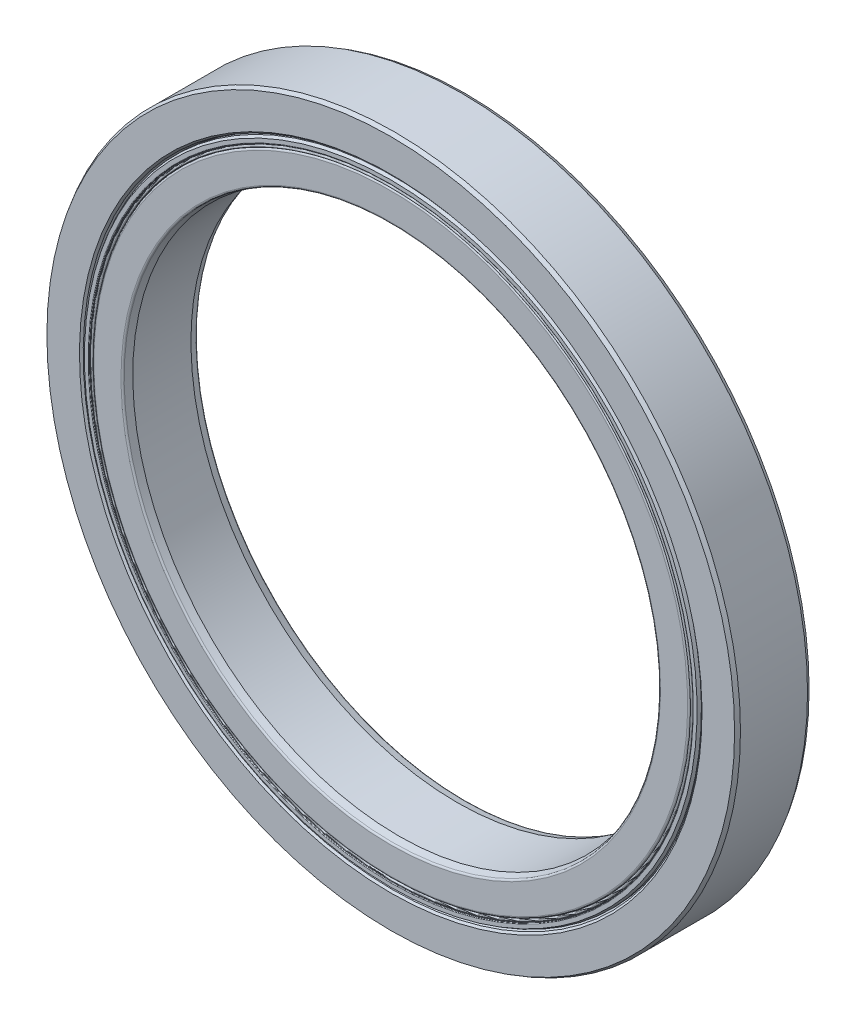
from build123d import *

# Parameters (mm, degrees)
CIRPATTERN1_COUNT = 20


with BuildPart() as part:
    # Sketch3 → Revolve1 (revolve)
    with BuildSketch(Plane(origin=(0, 0, 0), x_dir=(0, 0, -1), z_dir=(1, 0, 0)), mode=Mode.PRIVATE) as revolve1_sk:
        with BuildLine():
            Line((-2.945227749, 28.925), (-3.325, 29.063225795))
            Line((-3.325, 29.063225795), (-3.5, 29.238225795))
            Line((-3.5, 29.238225795), (-3.5, 32.297927406))
            Line((-3.5, 32.297927406), (-3.15, 32.5))
            Line((-3.15, 32.5), (3.15, 32.5))
            Line((3.15, 32.5), (3.5, 32.297927406))
            Line((3.5, 32.297927406), (3.5, 29.238225795))
            Line((3.5, 29.238225795), (3.325, 29.063225795))
            Line((3.325, 29.063225795), (2.945227749, 28.925))
            Line((2.945227749, 28.925), (2.779563315, 28.925))
            ThreePointArc((2.779563315, 28.925), (0, 31.308333333), (-2.779563315, 28.925))
            Line((-2.779563315, 28.925), (-2.945227749, 28.925))
        make_face()
    revolve(revolve1_sk.sketch.rotate(Axis((0, 0, 3.5), (0, 0, -1)), 180), axis=Axis((0, 0, 3.5), (0, 0, -1)))


with BuildPart() as body_2:
    # Sketch4 → Revolve2 (revolve)
    with BuildSketch(Plane(origin=(0, 0, 0), x_dir=(0, 0, -1), z_dir=(1, 0, 0)), mode=Mode.PRIVATE) as revolve2_sk:
        with BuildLine():
            Line((-2.731356293, 25), (-3.368914973, 25.170833333))
            ThreePointArc((-3.368914973, 25.170833333), (-3.463452538, 25.234001315), (-3.5, 25.341666667))
            Line((-3.5, 25.341666667), (-3.5, 27.889806986))
            ThreePointArc((-3.5, 27.889806986), (-3.448198999, 28.014865665), (-3.323140319, 28.066666667))
            Line((-3.323140319, 28.066666667), (-2.779563315, 28.066666667))
            ThreePointArc((-2.779563315, 28.066666667), (0, 25.683333333), (2.779563315, 28.066666667))
            Line((2.779563315, 28.066666667), (3.323140319, 28.066666667))
            ThreePointArc((3.323140319, 28.066666667), (3.448198999, 28.014865665), (3.5, 27.889806986))
            Line((3.5, 27.889806986), (3.5, 25.341666667))
            ThreePointArc((3.5, 25.341666667), (3.463452538, 25.234001315), (3.368914973, 25.170833333))
            Line((3.368914973, 25.170833333), (2.731356293, 25))
            Line((2.731356293, 25), (-2.731356293, 25))
        make_face()
    revolve(revolve2_sk.sketch.rotate(Axis((0, 0, 3.5), (0, 0, -1)), 180), axis=Axis((0, 0, 3.5), (0, 0, -1)))


with BuildPart() as body_3:
    # Sketch5 → Revolve3 (revolve)
    with BuildSketch(Plane(origin=(0, 0, 0), x_dir=(0, 0, -1), z_dir=(1, 0, 0))):
        with BuildLine():
            Line((-2.8125, 28.495833333), (2.8125, 28.495833333))
            ThreePointArc((2.8125, 28.495833333), (0, 31.308333333), (-2.8125, 28.495833333))
        make_face()
    revolve(axis=Axis((0, 28.495833333, 2.8125), (0, 0, -1)))


with BuildPart() as cirpattern1_1:
    # CirPattern1: pattern copy
    add(body_3.part.rotate(Axis((0, 0, 0), (0, 0, 1)), 1 * 360 / CIRPATTERN1_COUNT))


with BuildPart() as cirpattern1_2:
    # CirPattern1: pattern copy
    add(body_3.part.rotate(Axis((0, 0, 0), (0, 0, 1)), 2 * 360 / CIRPATTERN1_COUNT))


with BuildPart() as cirpattern1_3:
    # CirPattern1: pattern copy
    add(body_3.part.rotate(Axis((0, 0, 0), (0, 0, 1)), 3 * 360 / CIRPATTERN1_COUNT))


with BuildPart() as cirpattern1_4:
    # CirPattern1: pattern copy
    add(body_3.part.rotate(Axis((0, 0, 0), (0, 0, 1)), 4 * 360 / CIRPATTERN1_COUNT))


with BuildPart() as cirpattern1_5:
    # CirPattern1: pattern copy
    add(body_3.part.rotate(Axis((0, 0, 0), (0, 0, 1)), 5 * 360 / CIRPATTERN1_COUNT))


with BuildPart() as cirpattern1_6:
    # CirPattern1: pattern copy
    add(body_3.part.rotate(Axis((0, 0, 0), (0, 0, 1)), 6 * 360 / CIRPATTERN1_COUNT))


with BuildPart() as cirpattern1_7:
    # CirPattern1: pattern copy
    add(body_3.part.rotate(Axis((0, 0, 0), (0, 0, 1)), 7 * 360 / CIRPATTERN1_COUNT))


with BuildPart() as cirpattern1_8:
    # CirPattern1: pattern copy
    add(body_3.part.rotate(Axis((0, 0, 0), (0, 0, 1)), 8 * 360 / CIRPATTERN1_COUNT))


with BuildPart() as cirpattern1_9:
    # CirPattern1: pattern copy
    add(body_3.part.rotate(Axis((0, 0, 0), (0, 0, 1)), 9 * 360 / CIRPATTERN1_COUNT))


with BuildPart() as cirpattern1_10:
    # CirPattern1: pattern copy
    add(body_3.part.rotate(Axis((0, 0, 0), (0, 0, 1)), 10 * 360 / CIRPATTERN1_COUNT))


with BuildPart() as cirpattern1_11:
    # CirPattern1: pattern copy
    add(body_3.part.rotate(Axis((0, 0, 0), (0, 0, 1)), 11 * 360 / CIRPATTERN1_COUNT))


with BuildPart() as cirpattern1_12:
    # CirPattern1: pattern copy
    add(body_3.part.rotate(Axis((0, 0, 0), (0, 0, 1)), 12 * 360 / CIRPATTERN1_COUNT))


with BuildPart() as cirpattern1_13:
    # CirPattern1: pattern copy
    add(body_3.part.rotate(Axis((0, 0, 0), (0, 0, 1)), 13 * 360 / CIRPATTERN1_COUNT))


with BuildPart() as cirpattern1_14:
    # CirPattern1: pattern copy
    add(body_3.part.rotate(Axis((0, 0, 0), (0, 0, 1)), 14 * 360 / CIRPATTERN1_COUNT))


with BuildPart() as cirpattern1_15:
    # CirPattern1: pattern copy
    add(body_3.part.rotate(Axis((0, 0, 0), (0, 0, 1)), 15 * 360 / CIRPATTERN1_COUNT))


with BuildPart() as cirpattern1_16:
    # CirPattern1: pattern copy
    add(body_3.part.rotate(Axis((0, 0, 0), (0, 0, 1)), 16 * 360 / CIRPATTERN1_COUNT))


with BuildPart() as cirpattern1_17:
    # CirPattern1: pattern copy
    add(body_3.part.rotate(Axis((0, 0, 0), (0, 0, 1)), 17 * 360 / CIRPATTERN1_COUNT))


with BuildPart() as cirpattern1_18:
    # CirPattern1: pattern copy
    add(body_3.part.rotate(Axis((0, 0, 0), (0, 0, 1)), 18 * 360 / CIRPATTERN1_COUNT))


with BuildPart() as cirpattern1_19:
    # CirPattern1: pattern copy
    add(body_3.part.rotate(Axis((0, 0, 0), (0, 0, 1)), 19 * 360 / CIRPATTERN1_COUNT))


with BuildPart() as body_23:
    # Sketch6 → Revolve4 (revolve)
    with BuildSketch(Plane(origin=(0, 0, 0), x_dir=(0, 0, -1), z_dir=(1, 0, 0)), mode=Mode.PRIVATE) as revolve4_sk:
        with BuildLine():
            Line((-3.240192379, 28.925), (-2.8125, 28.925))
            Line((-2.8125, 28.925), (-2.8125, 28.366666667))
            Line((-2.8125, 28.366666667), (-3.44, 28.366666667))
            ThreePointArc((-3.44, 28.366666667), (-3.482426407, 28.38424026), (-3.5, 28.426666667))
            Line((-3.5, 28.426666667), (-3.5, 28.775))
            Line((-3.5, 28.775), (-3.240192379, 28.925))
        make_face()
        with BuildLine():
            Line((3.44, 28.366666667), (2.8125, 28.366666667))
            Line((2.8125, 28.366666667), (2.8125, 28.925))
            Line((2.8125, 28.925), (3.240192379, 28.925))
            Line((3.240192379, 28.925), (3.5, 28.775))
            Line((3.5, 28.775), (3.5, 28.426666667))
            ThreePointArc((3.5, 28.426666667), (3.482426407, 28.38424026), (3.44, 28.366666667))
        make_face()
    revolve(revolve4_sk.sketch.rotate(Axis((0, 0, 3.5), (0, 0, -1)), 180), axis=Axis((0, 0, 3.5), (0, 0, -1)))


with BuildPart() as body_24:
    # Sketch7 → Revolve5 (revolve)
    with BuildSketch(Plane(origin=(0, 0, 0), x_dir=(0, 0, -1), z_dir=(1, 0, 0)), mode=Mode.PRIVATE) as revolve5_sk:
        with BuildLine():
            Line((-2.8125, 28.366666667), (-3.29406165, 28.366666667))
            Line((-3.29406165, 28.366666667), (-3.367922231, 28.353643053))
            ThreePointArc((-3.367922231, 28.353643053), (-3.393606563, 28.32017058), (-3.3625, 28.291666667))
            Line((-3.3625, 28.291666667), (-3.3875, 28.291666667))
            ThreePointArc((-3.3875, 28.291666667), (-3.5, 28.179166667), (-3.3875, 28.066666667))
            Line((-3.3875, 28.066666667), (-2.8125, 28.066666667))
            Line((-2.8125, 28.066666667), (-2.8125, 28.366666667))
        make_face()
    revolve(revolve5_sk.sketch.rotate(Axis((0, 0, 3.5), (0, 0, -1)), 180), axis=Axis((0, 0, 3.5), (0, 0, -1)))


solid = Compound([part.part, body_2.part, body_3.part, cirpattern1_1.part, cirpattern1_2.part, cirpattern1_3.part, cirpattern1_4.part, cirpattern1_5.part, cirpattern1_6.part, cirpattern1_7.part, cirpattern1_8.part, cirpattern1_9.part, cirpattern1_10.part, cirpattern1_11.part, cirpattern1_12.part, cirpattern1_13.part, cirpattern1_14.part, cirpattern1_15.part, cirpattern1_16.part, cirpattern1_17.part, cirpattern1_18.part, cirpattern1_19.part, body_23.part, body_24.part])
